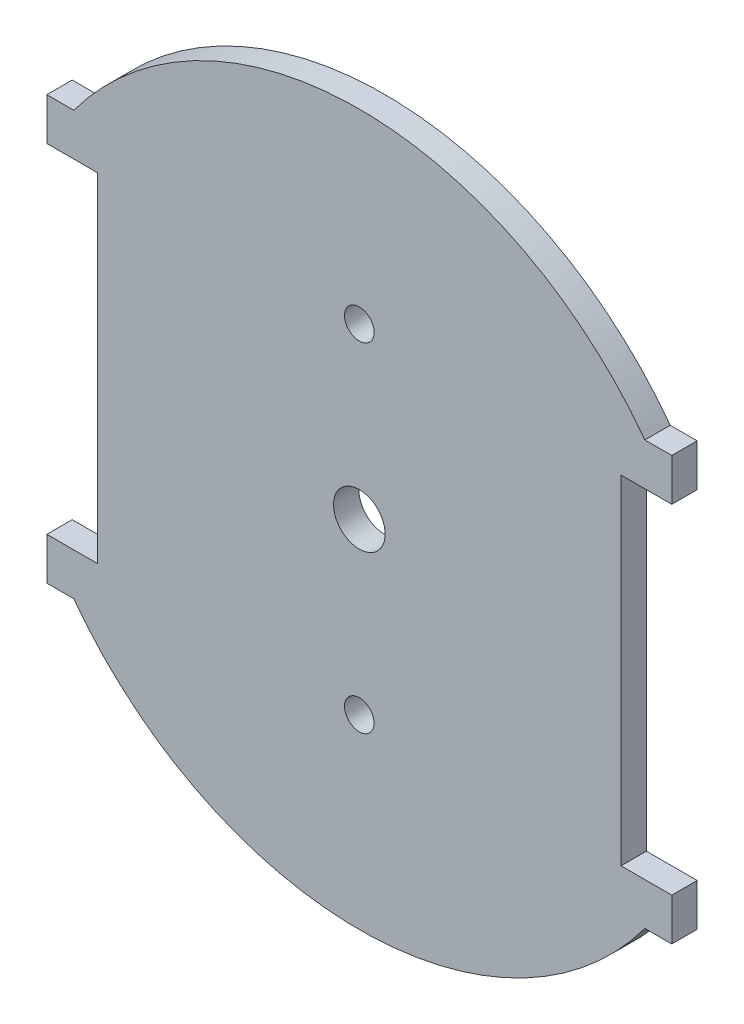
from build123d import *

# Parameters (mm, degrees)
CROQUIS1_R              = 3.05
CROQUIS1_R_2            = 1.75
SALIENTE_EXTRUIR1_DEPTH = 3


with BuildPart() as part:
    # Croquis1 → Saliente-Extruir1 (new body)
    with BuildSketch(Plane.XY):
        with BuildLine():
            Line((-36.932370625, 20), (-30.932370625, 20))
            Line((-30.932370625, 20), (-30.932370625, -20))
            Line((-30.932370625, -20), (-36.932370625, -20))
            Line((-36.932370625, -20), (-36.932370625, -25))
            Line((-36.932370625, -25), (-33.749074061, -25))
            ThreePointArc((-33.749074061, -25), (0, -42), (33.749074061, -25))
            Line((33.749074061, -25), (36.932370625, -25))
            Line((36.932370625, -25), (36.932370625, -20))
            Line((36.932370625, -20), (30.932370625, -20))
            Line((30.932370625, -20), (30.932370625, 20))
            Line((30.932370625, 20), (36.932370625, 20))
            Line((36.932370625, 20), (36.932370625, 25))
            Line((36.932370625, 25), (33.749074061, 25))
            ThreePointArc((33.749074061, 25), (0, 42), (-33.749074061, 25))
            Line((-33.749074061, 25), (-36.932370625, 25))
            Line((-36.932370625, 25), (-36.932370625, 20))
        make_face()
        Circle(CROQUIS1_R, mode=Mode.SUBTRACT)
        with Locations((0, 20)):
            Circle(CROQUIS1_R_2, mode=Mode.SUBTRACT)
        with Locations((0, -20)):
            Circle(CROQUIS1_R_2, mode=Mode.SUBTRACT)
    extrude(amount=SALIENTE_EXTRUIR1_DEPTH)


solid = part.part
